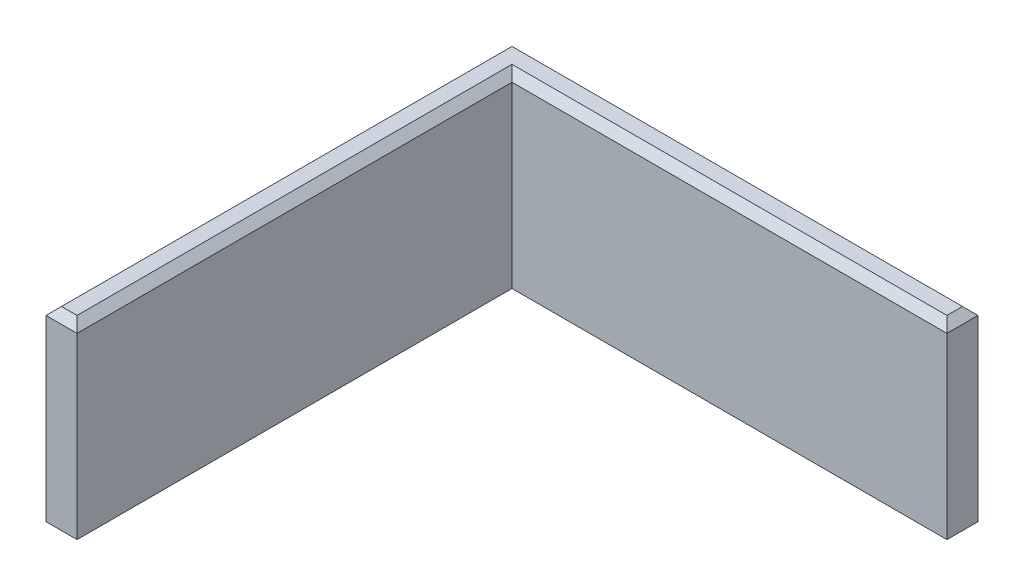
from build123d import *

# Parameters (mm, degrees)
BOSS_EXTRUDE1_DEPTH = 25
CHAMFER1_SIZE       = 1
FILLET1_R           = 2


with BuildPart() as part:
    # Sketch1 → Boss-Extrude1 (new body)
    with BuildSketch(Plane(origin=(0, 0, 0), x_dir=(1, 0, 0), z_dir=(0, 1, 0))):
        Polygon((0, 0), (0, -56), (-4, -56), (-4, 0), (-4, 4), (56, 4), (56, 0), align=None)
    extrude(amount=BOSS_EXTRUDE1_DEPTH)

    # Chamfer1
    chamfer1_edges = [part.edges().sort_by_distance(p)[0] for p in [
        (28, 0, 0),
        (26, 25, -4),
        (-4, 25, 26),
        (-2, 25, 56),
        (0, 25, 28),
        (28, 25, 0),
        (0, 0, 28),
        (-2, 0, 56),
        (-4, 0, 26),
        (56, 25, -2),
        (26, 0, -4),
        (56, 0, -2),
    ]]
    chamfer(chamfer1_edges, length=CHAMFER1_SIZE)

    # Fillet1
    fillet1_edges = [part.edges().sort_by_distance(p)[0] for p in [
        (-4, 12.5, -4),
    ]]
    fillet(fillet1_edges, radius=FILLET1_R)


solid = part.part
